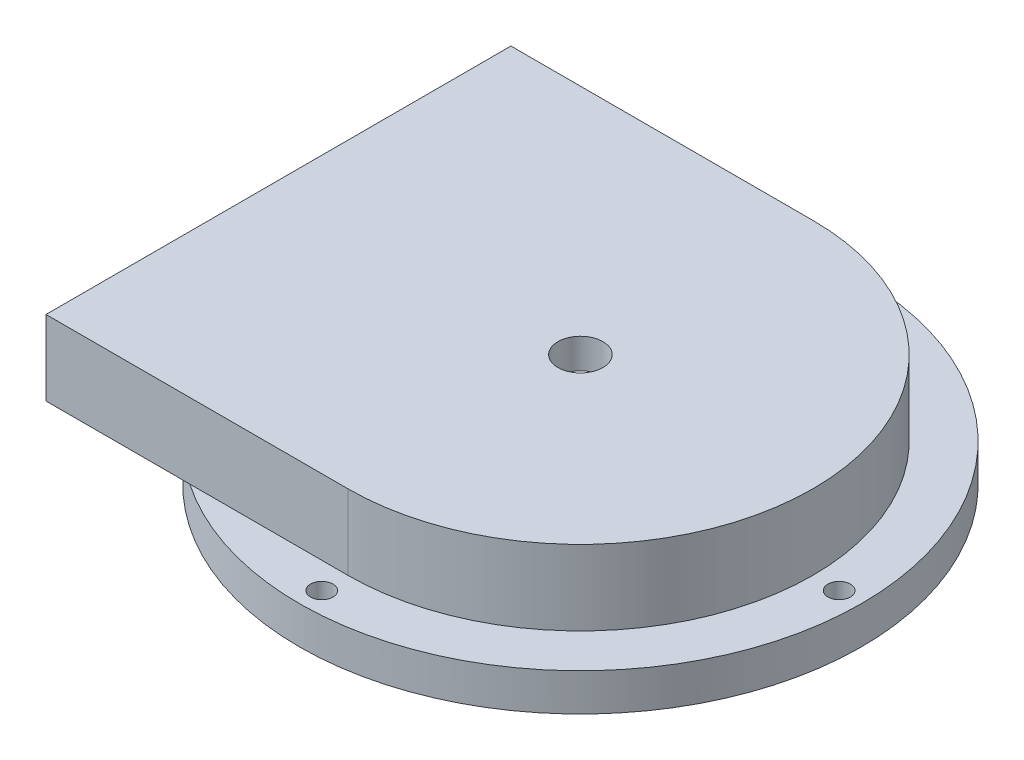
from build123d import *

# Parameters (mm, degrees)
SKETCH1_R               = 37.5
SKETCH1_R_2             = 27.5
BOSS_EXTRUDE1_DEPTH     = 5
BOSS_EXTRUDE2_DEPTH     = 10
SKETCH3_R               = 27.5
CUT_EXTRUDE2_DEPTH      = 6
CUT_EXTRUDE3_DEPTH      = 58.034295486
CUT_EXTRUDE3_DEPTH_BACK = 58.034295486
SKETCH4_R               = 3
SKETCH5_R               = 1.5
CUT_EXTRUDE4_DEPTH      = 56.927728914


with BuildPart() as part:
    # Sketch1 → Boss-Extrude1 (new body)
    with BuildSketch(Plane(origin=(0, 0, 0), x_dir=(1, 0, 0), z_dir=(0, 1, 0))):
        with Locations(Location((0, 0, 0), (0, 0, 270))):
            Circle(SKETCH1_R)
        with Locations(Location((0, 0, 0), (0, 0, 270))):
            Circle(SKETCH1_R_2, mode=Mode.SUBTRACT)
    extrude(amount=BOSS_EXTRUDE1_DEPTH)

    # Sketch2 → Boss-Extrude2 (add)
    with BuildSketch(Plane(origin=(0, 5, 0), x_dir=(1, 0, 0), z_dir=(0, 1, 0))):
        with BuildLine():
            Line((0, 31), (-40.269850528, 31))
            Line((-40.269850528, 31), (-40.269850528, -31))
            Line((-40.269850528, -31), (0, -31))
            ThreePointArc((0, -31), (31, 0), (0, 31))
        make_face()
    extrude(amount=BOSS_EXTRUDE2_DEPTH)

    # Sketch3 → Cut-Extrude2 (cut)
    with BuildSketch(Plane.XZ.offset(-5)):
        with Locations(Location((0, 0, 0), (0, 0, 90))):
            Circle(SKETCH3_R)
    extrude(amount=-CUT_EXTRUDE2_DEPTH, mode=Mode.SUBTRACT)

    # Sketch4 → Cut-Extrude3 (cut, two sides: drawn at the far end of the back side and taken through both)
    with BuildSketch(Plane(origin=(0, 15, 0), x_dir=(1, 0, 0), z_dir=(0, 1, 0)).offset(-CUT_EXTRUDE3_DEPTH_BACK)):
        with Locations(Location((0, 0, 0), (0, 0, 270))):
            Circle(SKETCH4_R)
    extrude(amount=CUT_EXTRUDE3_DEPTH + CUT_EXTRUDE3_DEPTH_BACK, mode=Mode.SUBTRACT)

    # Sketch5 → Cut-Extrude4 (cut, through all)
    with BuildSketch(Plane(origin=(0, 5, 0), x_dir=(1, 0, 0), z_dir=(0, 1, 0))):
        with Locations(Location((34.5, 0, 0), (0, 0, 270))):
            Circle(SKETCH5_R)
        with Locations(Location((0, -34.5, 0), (0, 0, 270))):
            Circle(SKETCH5_R)
        with Locations(Location((-34.5, 0, 0), (0, 0, 270))):
            Circle(SKETCH5_R)
        with Locations(Location((0, 34.5, 0), (0, 0, 270))):
            Circle(SKETCH5_R)
    extrude(amount=-CUT_EXTRUDE4_DEPTH, mode=Mode.SUBTRACT)


solid = part.part
